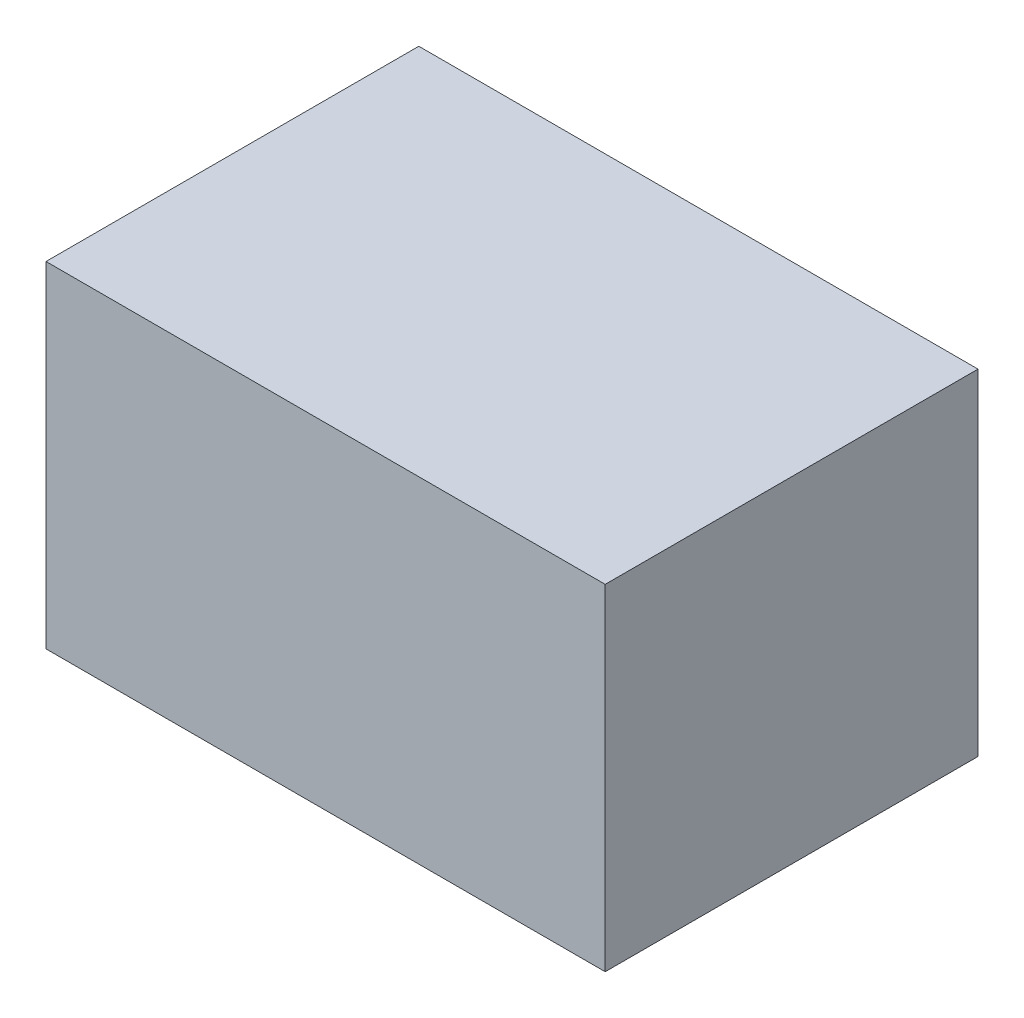
from build123d import *

# Parameters (mm, degrees)
SKETCH1_W           = 30
SKETCH1_H           = 20
BOSS_EXTRUDE1_DEPTH = 18


with BuildPart() as part:
    # Sketch1 → Boss-Extrude1 (new body)
    with BuildSketch(Plane(origin=(0, 0, 0), x_dir=(1, 0, 0), z_dir=(0, 1, 0))):
        Rectangle(SKETCH1_W, SKETCH1_H)
    extrude(amount=BOSS_EXTRUDE1_DEPTH)


solid = part.part
